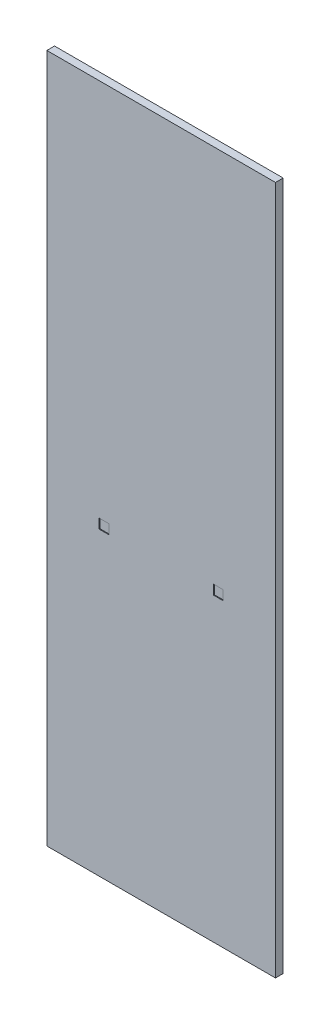
from build123d import *

# Parameters (mm, degrees)
SKETCH1_W           = 596
SKETCH1_H           = 1796
BOSS_EXTRUDE1_DEPTH = 20
SKETCH2_W           = 25
SKETCH2_H           = 25
CUT_EXTRUDE1_DEPTH  = 2


with BuildPart() as part:
    # Sketch1 → Boss-Extrude1 (new body)
    with BuildSketch(Plane.XY):
        Rectangle(SKETCH1_W, SKETCH1_H)
    extrude(amount=BOSS_EXTRUDE1_DEPTH)

    # Sketch2 → Cut-Extrude1 (cut)
    with BuildSketch(Plane.XY.offset(20)):
        with Locations((-149, -102)):
            Rectangle(SKETCH2_W, SKETCH2_H)
        with Locations((149, -102)):
            Rectangle(SKETCH2_W, SKETCH2_H)
    extrude(amount=-CUT_EXTRUDE1_DEPTH, mode=Mode.SUBTRACT)


solid = part.part
